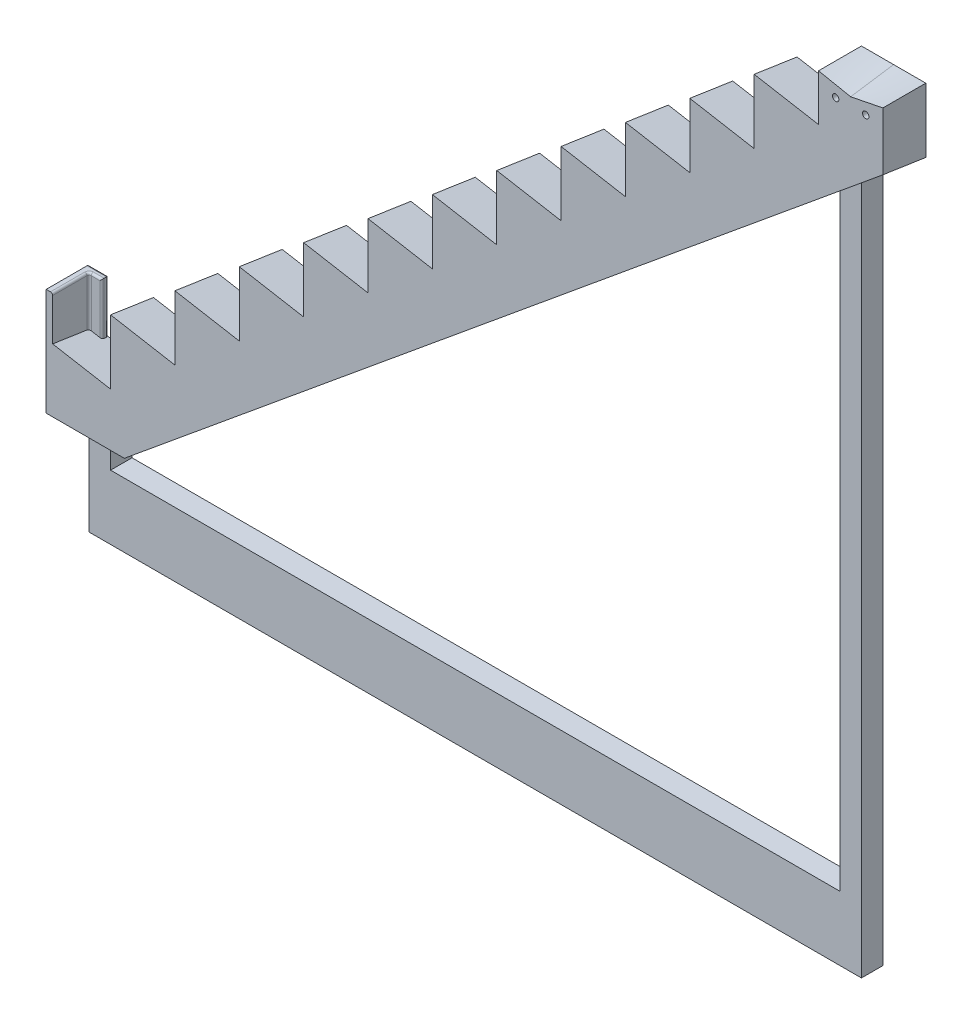
from build123d import *

# Parameters (mm, degrees)
BOSS_EXTRUDE3_DEPTH      = 20
BOSS_EXTRUDE3_DEPTH_BACK = 13
FILLET2_R                = 1
BOSS_EXTRUDE4_DEPTH      = 20
BOSS_EXTRUDE4_DEPTH_BACK = 40
SKETCH10_W               = 10
SKETCH10_H               = 10
BOSS_EXTRUDE5_DEPTH      = 300
BOSS_EXTRUDE5_DEPTH_BACK = 40
SKETCH12_W               = 10
SKETCH12_H               = 10
SKETCH13_W               = 360
SKETCH13_H               = 30
BOSS_EXTRUDE6_DEPTH      = 10
SKETCH14_R               = 1.5
CUT_EXTRUDE1_DEPTH       = 10


with BuildPart() as part:
    # Sketch1 → Loft1 section 0
    with BuildSketch(Plane.XY):
        with BuildLine():
            Line((0, 0), (-30, 5.289809421))
            Line((-30, 5.289809421), (-30, -24.710190579))
            Line((-30, -24.710190579), (-60, -19.420381157))
            Line((-60, -19.420381157), (-60, -49.420381157))
            Line((-60, -49.420381157), (-90, -44.130571736))
            Line((-90, -44.130571736), (-90, -74.130571736))
            Line((-90, -74.130571736), (-120, -68.840762315))
            Line((-120, -68.840762315), (-120, -98.840762315))
            Line((-120, -98.840762315), (-150, -93.550952894))
            Line((-150, -93.550952894), (-150, -123.550952894))
            Line((-150, -123.550952894), (-180, -118.261143472))
            Line((-180, -118.261143472), (-180, -148.261143472))
            Line((-180, -148.261143472), (-210, -142.971334051))
            Line((-210, -142.971334051), (-210, -172.971334051))
            Line((-210, -172.971334051), (-240, -167.68152463))
            Line((-240, -167.68152463), (-240, -197.68152463))
            Line((-240, -197.68152463), (-270, -192.391715209))
            Line((-270, -192.391715209), (-270, -222.391715209))
            Line((-270, -222.391715209), (-300, -217.101905787))
            Line((-300, -217.101905787), (-300, -247.101905787))
            Line((-300, -247.101905787), (-330, -241.812096366))
            Line((-330, -241.812096366), (-330, -271.812096366))
            Line((-330, -271.812096366), (-360, -266.522286945))
            Line((-360, -266.522286945), (-360, -296.522286945))
            Line((-360, -296.522286945), (-390, -291.232477524))
            Line((-390, -291.232477524), (-390, -321.232477524))
            Line((-390, -321.232477524), (-353.577779899, -321.232477524))
            Line((-353.577779899, -321.232477524), (0, -30))
            Line((0, -30), (0, 0))
        make_face()
    # Sketch2 → Loft1 section 1
    with BuildSketch(Plane.XY.offset(-20)):
        with BuildLine():
            Line((-353.577779899, -324.232477524), (-390, -324.232477524))
            Line((-390, -324.232477524), (-390, -294.232477524))
            Line((-390, -294.232477524), (-360, -299.522286945))
            Line((-360, -299.522286945), (-360, -269.522286945))
            Line((-360, -269.522286945), (-330, -274.812096366))
            Line((-330, -274.812096366), (-330, -244.812096366))
            Line((-330, -244.812096366), (-300, -250.101905787))
            Line((-300, -250.101905787), (-300, -220.101905787))
            Line((-300, -220.101905787), (-270, -225.391715209))
            Line((-270, -225.391715209), (-270, -195.391715209))
            Line((-270, -195.391715209), (-240, -200.68152463))
            Line((-240, -200.68152463), (-240, -170.68152463))
            Line((-240, -170.68152463), (-210, -175.971334051))
            Line((-210, -175.971334051), (-210, -145.971334051))
            Line((-210, -145.971334051), (-180, -151.261143472))
            Line((-180, -151.261143472), (-180, -121.261143472))
            Line((-180, -121.261143472), (-150, -126.550952894))
            Line((-150, -126.550952894), (-150, -96.550952894))
            Line((-150, -96.550952894), (-120, -101.840762315))
            Line((-120, -101.840762315), (-120, -71.840762315))
            Line((-120, -71.840762315), (-90, -77.130571736))
            Line((-90, -77.130571736), (-90, -47.130571736))
            Line((-90, -47.130571736), (-60, -52.420381157))
            Line((-60, -52.420381157), (-60, -22.420381157))
            Line((-60, -22.420381157), (-30, -27.710190579))
            Line((-30, -27.710190579), (-30, 2.289809421))
            Line((-30, 2.289809421), (0, -3))
            Line((0, -3), (0, -33))
            Line((0, -33), (-353.577779899, -324.232477524))
        make_face()
    loft()

    # Sketch8 → Cut-Loft1 section 0
    with BuildSketch(Plane(origin=(0, 0, -20), x_dir=(-1, 0, 0), z_dir=(0, 0, -1))):
        with BuildLine():
            Line((0, -3), (30, -3))
            Line((30, -3), (30, 5.289809421))
            Line((30, 5.289809421), (0, 5.289809421))
            Line((0, 5.289809421), (0, -3))
        make_face()
    # Sketch7 → Cut-Loft1 section 1
    with BuildSketch(Plane.XY):
        with BuildLine():
            Line((0, 5.289809421), (-30, 5.289809421))
            Line((-30, 5.289809421), (-30, -3))
            Line((-30, -3), (-15, -6))
            Line((-15, -6), (0, -3))
            Line((0, -3), (0, 5.289809421))
        make_face()
    loft(mode=Mode.SUBTRACT)

    # Sketch9 → Boss-Extrude3 (add, two sides: drawn at the far end of the back side and taken through both)
    with BuildSketch(Plane(origin=(0, -291.232477524, 0), x_dir=(1, 0, 0), z_dir=(0, 1, 0)).offset(-BOSS_EXTRUDE3_DEPTH_BACK)):
        Polygon((-390, 0), (-390, 20), (-381, 20), (-381, 17), (-387, 17), (-387, 0), align=None)
    extrude(amount=BOSS_EXTRUDE3_DEPTH + BOSS_EXTRUDE3_DEPTH_BACK)

    # Fillet2
    fillet2_edges = [part.edges().sort_by_distance(p)[0] for p in [
        (-387, -271.232477524, -8.5),
        (-385.5, -271.232477524, -20),
        (-384, -271.232477524, -17),
        (-381, -283.525948937, -20),
        (-381, -283.300948937, -17),
        (-387, -282.771967995, -17),
    ]]
    fillet(fillet2_edges, radius=FILLET2_R)

    # Sketch12 → Boss-Extrude5 (add, two sides: drawn at the far end of the back side and taken through both)
    with BuildSketch(Plane(origin=(0, -324.232477524, 0), x_dir=(1, 0, 0), z_dir=(0, 1, 0)).offset(-BOSS_EXTRUDE5_DEPTH_BACK)):
        with Locations((-20, 10)):
            Rectangle(SKETCH12_W, SKETCH12_H)
    extrude(amount=BOSS_EXTRUDE5_DEPTH + BOSS_EXTRUDE5_DEPTH_BACK)



with BuildPart() as body_2:
    # Sketch10 → Boss-Extrude4 (new, two sides: drawn at the far end of the back side and taken through both)
    with BuildSketch(Plane(origin=(0, -324.232477524, 0), x_dir=(1, 0, 0), z_dir=(0, 1, 0)).offset(-BOSS_EXTRUDE4_DEPTH_BACK)):
        with Locations((-370, 10)):
            Rectangle(SKETCH10_W, SKETCH10_H)
    extrude(amount=BOSS_EXTRUDE4_DEPTH + BOSS_EXTRUDE4_DEPTH_BACK)


with BuildPart() as part_1:
    add(part.part)

    add(body_2.part)  # Boss-Extrude6 merges body 2
    # Sketch13 → Boss-Extrude6 (add)
    with BuildSketch(Plane(origin=(0, 0, -15), x_dir=(-1, 0, 0), z_dir=(0, 0, -1))):
        with Locations((195, -349.232477524)):
            Rectangle(SKETCH13_W, SKETCH13_H)
    extrude(amount=-BOSS_EXTRUDE6_DEPTH)

    # Sketch14 → Cut-Extrude1 (cut)
    with BuildSketch(Plane.XY):
        with Locations((-22, -9.855095289)):
            Circle(SKETCH14_R)
        with Locations((-8, -9.855095289)):
            Circle(SKETCH14_R)
    extrude(amount=-CUT_EXTRUDE1_DEPTH, mode=Mode.SUBTRACT)


solid = part_1.part
